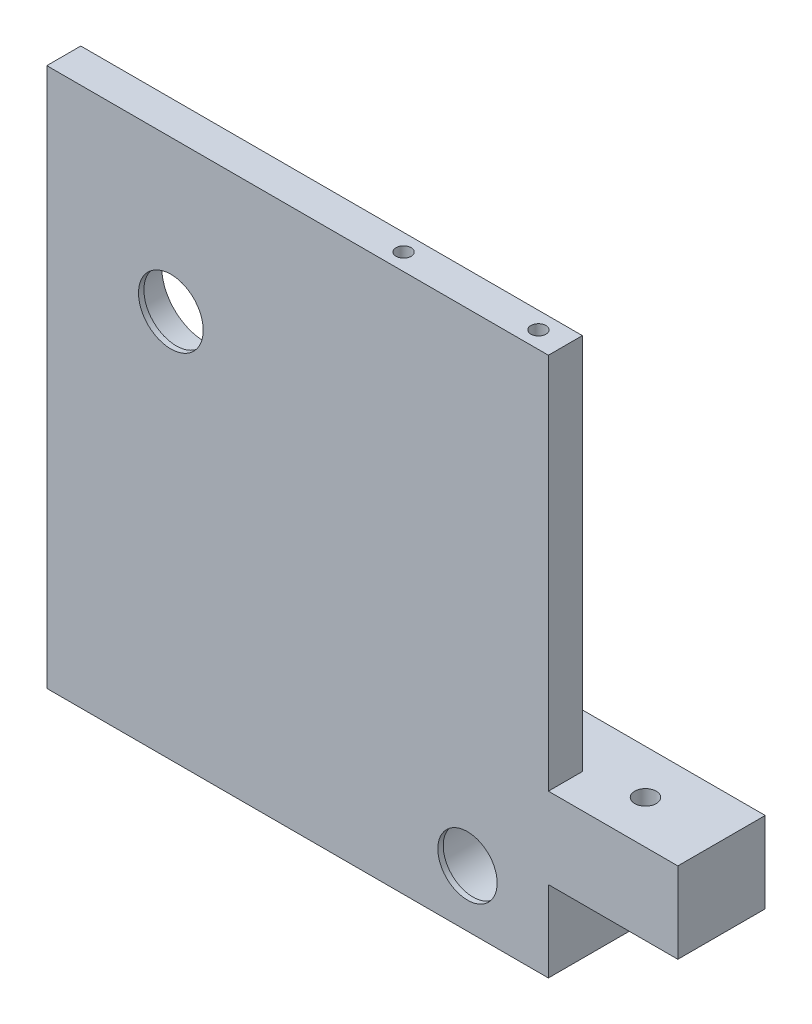
from build123d import *

# Parameters (mm, degrees)
SKETCH1_W           = 93
SKETCH1_H           = 100
BOSS_EXTRUDE2_DEPTH = 6.3
SKETCH3_W           = 40
SKETCH3_H           = 100
BOSS_EXTRUDE3_DEPTH = 9.9
SKETCH4_W           = 16.2
SKETCH4_H           = 15
BOSS_EXTRUDE4_DEPTH = 24
SKETCH5_R           = 2
CUT_EXTRUDE1_DEPTH  = 50
SKETCH6_R           = 7.5
CUT_EXTRUDE2_DEPTH  = 50
SKETCH7_R           = 8
CUT_EXTRUDE3_DEPTH  = 50
EXTRUDE_THIN1_START = -5.3
SKETCH7_2_R         = 8
SKETCH7_2_R_2       = 6
EXTRUDE_THIN1_DEPTH = 1
EXTRUDE_THIN2_START = -15.2
SKETCH6_2_R         = 7.5
SKETCH6_2_R_2       = 5.5
EXTRUDE_THIN2_DEPTH = 1
SKETCH8_R           = 1.4
CUT_EXTRUDE4_DEPTH  = 20
SKETCH9_W           = 40
SKETCH9_H           = 70
CUT_EXTRUDE5_DEPTH  = 9.9
SKETCH10_R          = 1.4
CUT_EXTRUDE6_DEPTH  = 15


with BuildPart() as part:
    # Sketch1 → Boss-Extrude2 (new body)
    with BuildSketch(Plane.XY):
        with Locations((-29.68705036, 14.928057554)):
            Rectangle(SKETCH1_W, SKETCH1_H)
    extrude(amount=BOSS_EXTRUDE2_DEPTH)

    # Sketch3 → Boss-Extrude3 (add)
    with BuildSketch(Plane(origin=(0, 0, 0), x_dir=(-1, 0, 0), z_dir=(0, 0, -1))):
        with Locations((3.18705036, 14.928057554)):
            Rectangle(SKETCH3_W, SKETCH3_H)
    extrude(amount=BOSS_EXTRUDE3_DEPTH)

    # Sketch4 → Boss-Extrude4 (add)
    with BuildSketch(Plane(origin=(16.81294964, 0, 0), x_dir=(0, 0, -1), z_dir=(1, 0, 0))):
        with Locations((1.8, -12.571942446)):
            Rectangle(SKETCH4_W, SKETCH4_H)
    extrude(amount=BOSS_EXTRUDE4_DEPTH)

    # Sketch5 → Cut-Extrude1 (cut)
    with BuildSketch(Plane(origin=(0, -5.071942446, 0), x_dir=(1, 0, 0), z_dir=(0, 1, 0))):
        with Locations(Location((26.81294964, 1.7, 0), (0, 0, 180))):
            Circle(SKETCH5_R)
    extrude(amount=-CUT_EXTRUDE1_DEPTH, mode=Mode.SUBTRACT)

    # Sketch6 → Cut-Extrude2 (cut)
    with BuildSketch(Plane(origin=(0, 0, -9.9), x_dir=(-1, 0, 0), z_dir=(0, 0, -1))):
        with Locations((-1.81294964, -24.571942446)):
            Circle(SKETCH6_R)
    extrude(amount=-CUT_EXTRUDE2_DEPTH, mode=Mode.SUBTRACT)

    # Sketch7 → Cut-Extrude3 (cut)
    with BuildSketch(Plane(origin=(0, 0, 0), x_dir=(-1, 0, 0), z_dir=(0, 0, -1))):
        with Locations((53.18705036, 36.928057554)):
            Circle(SKETCH7_R)
    extrude(amount=-CUT_EXTRUDE3_DEPTH, mode=Mode.SUBTRACT)

    # Sketch7<2> → Extrude-Thin1 (add)
    with BuildSketch(Plane(origin=(0, 0, 0), x_dir=(-1, 0, 0), z_dir=(0, 0, -1)).offset(EXTRUDE_THIN1_START)):
        with Locations((53.18705036, 36.928057554)):
            Circle(SKETCH7_2_R)
        with Locations((53.18705036, 36.928057554)):
            Circle(SKETCH7_2_R_2, mode=Mode.SUBTRACT)
    extrude(amount=-EXTRUDE_THIN1_DEPTH)

    # Sketch6<2> → Extrude-Thin2 (add)
    with BuildSketch(Plane(origin=(0, 0, -9.9), x_dir=(-1, 0, 0), z_dir=(0, 0, -1)).offset(EXTRUDE_THIN2_START)):
        with Locations((-1.81294964, -24.571942446)):
            Circle(SKETCH6_2_R)
        with Locations((-1.81294964, -24.571942446)):
            Circle(SKETCH6_2_R_2, mode=Mode.SUBTRACT)
    extrude(amount=-EXTRUDE_THIN2_DEPTH)

    # Sketch8 → Cut-Extrude4 (cut)
    with BuildSketch(Plane(origin=(0, 64.928057554, 0), x_dir=(1, 0, 0), z_dir=(0, 1, 0))):
        with Locations(Location((-15.68705036, 1.8, 0), (0, 0, 270))):
            Circle(SKETCH8_R)
        with Locations(Location((9.31294964, 1.8, 0), (0, 0, 270))):
            Circle(SKETCH8_R)
    extrude(amount=-CUT_EXTRUDE4_DEPTH, mode=Mode.SUBTRACT)

    # Sketch9 → Cut-Extrude5 (cut)
    with BuildSketch(Plane(origin=(0, 0, -9.9), x_dir=(-1, 0, 0), z_dir=(0, 0, -1))):
        with Locations((3.18705036, 29.928057554)):
            Rectangle(SKETCH9_W, SKETCH9_H)
    extrude(amount=-CUT_EXTRUDE5_DEPTH, mode=Mode.SUBTRACT)

    # Sketch10 → Cut-Extrude6 (cut)
    with BuildSketch(Plane(origin=(0, 64.928057554, 0), x_dir=(1, 0, 0), z_dir=(0, 1, 0))):
        with Locations(Location((11.81294964, -3.15, 0), (0, 0, 270))):
            Circle(SKETCH10_R)
        with Locations(Location((-13.18705036, -3.15, 0), (0, 0, 270))):
            Circle(SKETCH10_R)
    extrude(amount=-CUT_EXTRUDE6_DEPTH, mode=Mode.SUBTRACT)


solid = part.part
